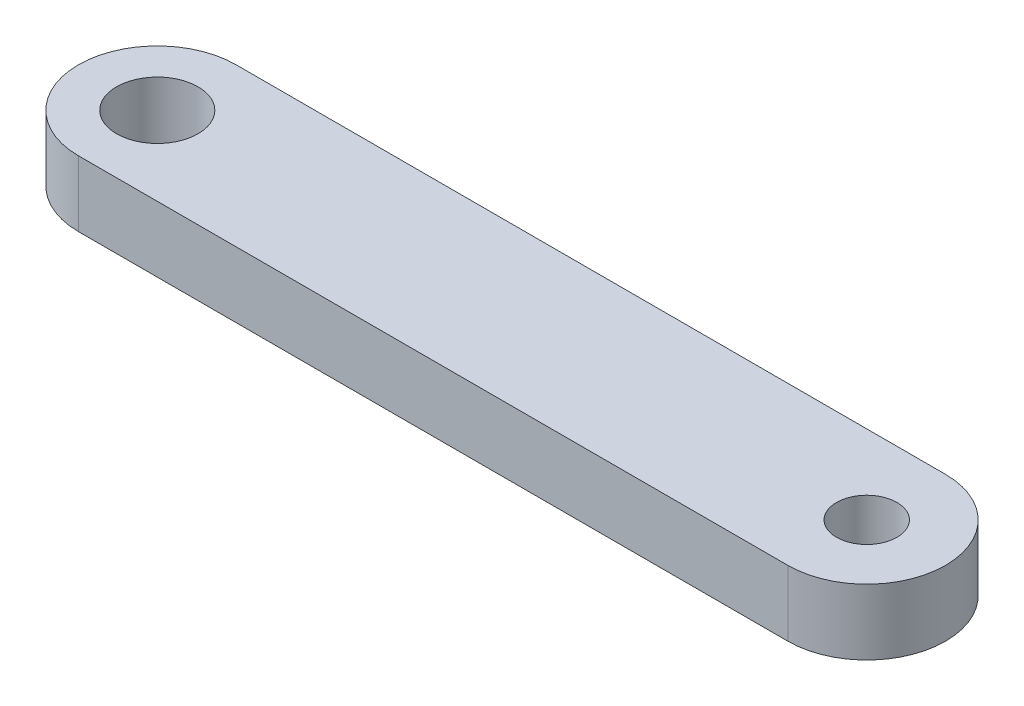
from build123d import *

# Parameters (mm, degrees)
SKETCH_1_R      = 1.55
SKETCH_1_R_2    = 1.15
EXTRUDE_1_DEPTH = 2.5


with BuildPart() as part:
    # 草图1 → 凸台-拉伸1 (new body)
    with BuildSketch(Plane(origin=(0, 0, 0), x_dir=(1, 0, 0), z_dir=(0, 1, 0))):
        with BuildLine():
            Line((-13.5, 3), (13.5, 3))
            ThreePointArc((13.5, 3), (16.5, 0), (13.5, -3))
            Line((13.5, -3), (-13.5, -3))
            ThreePointArc((-13.5, -3), (-16.5, 0), (-13.5, 3))
        make_face()
        with Locations(Location((-13.5, 0, 0), (0, 0, 270))):
            Circle(SKETCH_1_R, mode=Mode.SUBTRACT)
        with Locations(Location((13.5, 0, 0), (0, 0, 270))):
            Circle(SKETCH_1_R_2, mode=Mode.SUBTRACT)
    extrude(amount=EXTRUDE_1_DEPTH)


solid = part.part
